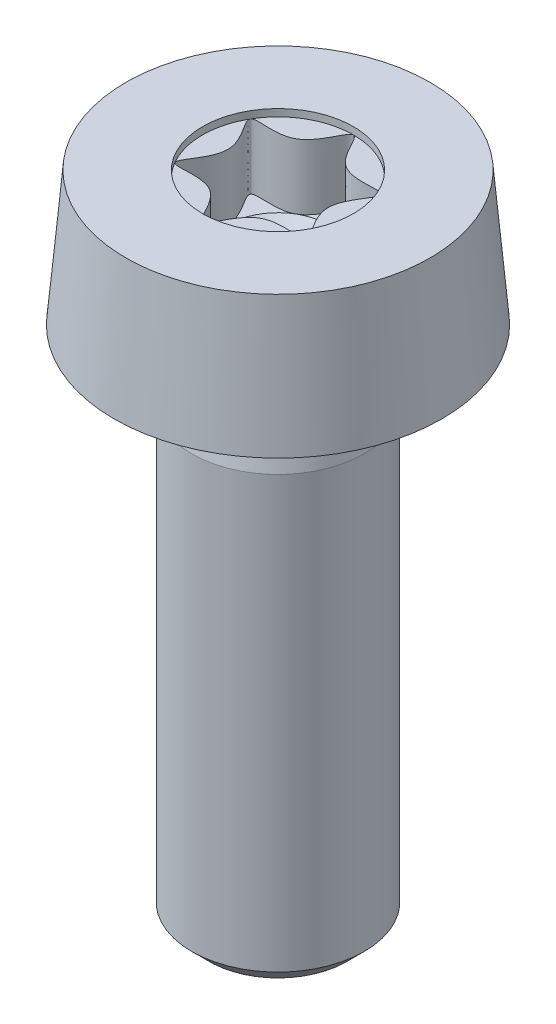
from build123d import *

# Parameters (mm, degrees)
FILLET1_R                 = 0.1
SOCKET_CUT_EXTRUDE1_DEPTH = 0.84
SKETCH3_R                 = 0.875
SOCKET_CUT_EXTRUDE2_DEPTH = 0.084
CHAFL_N1_SIZE             = 0.2


with BuildPart() as part:
    # Sketch1 → Body-Revolve (revolve)
    with BuildSketch(Plane.XY, mode=Mode.PRIVATE) as body_revolve_sk:
        Polygon((0, 7.55), (1.764392572, 7.55), (1.9, 6), (1, 6), (0.84, 6), (1, 5.2), (1, 0), (0, 0), align=None)
    revolve(body_revolve_sk.sketch.rotate(Axis((0, 0, 0), (0, 1, 0)), 90), axis=Axis((0, 0, 0), (0, 1, 0)))

    # Fillet1
    fillet1_edges = [part.edges().sort_by_distance(p)[0] for p in [
        (0, 6, 0.84),
    ]]
    fillet(fillet1_edges, radius=FILLET1_R)

    # Sketch2 → Socket-Cut-Extrude1 (cut)
    with BuildSketch(Plane(origin=(0, 7.55, 0), x_dir=(-1, 0, 0), z_dir=(0, 1, 0))):
        with BuildLine():
            add(Edge.make_bspline(
                [(0, -0.875), (-0.062906837, -0.875), (-0.18872051, -0.326873512), (-0.99511796, -0.574531622), (-0.37744102, 0), (-0.99511796, 0.574531622), (-0.18872051, 0.326873512), (0, 1.149063244), (0.18872051, 0.326873512), (0.99511796, 0.574531622), (0.37744102, 0), (0.99511796, -0.574531622), (0.18872051, -0.326873512), (0.062906837, -0.875), (0, -0.875)],
                knots=[0, 0, 0, 0, 0.083333333, 0.166666667, 0.25, 0.333333333, 0.416666667, 0.5, 0.583333333, 0.666666667, 0.75, 0.833333333, 0.916666667, 1, 1, 1, 1], degree=3))
        make_face()
    extrude(amount=-SOCKET_CUT_EXTRUDE1_DEPTH, mode=Mode.SUBTRACT)

    # Sketch3 → Socket-Cut-Extrude2 (cut)
    with BuildSketch(Plane(origin=(0, 7.55, 0), x_dir=(-1, 0, 0), z_dir=(0, 1, 0))):
        with Locations(Location((0, 0, 0), (0, 0, 90))):
            Circle(SKETCH3_R)
    extrude(amount=-SOCKET_CUT_EXTRUDE2_DEPTH, mode=Mode.SUBTRACT)

    # Sketch4 → Drill-Cut-Revolve (revolve, cut)
    with BuildSketch(Plane.XY, mode=Mode.PRIVATE) as drill_cut_revolve_sk:
        Polygon((0, 6.71), (0.583333333, 6.71), (0, 6.155), align=None)
    revolve(drill_cut_revolve_sk.sketch.rotate(Axis((0, 0, 0), (0, 1, 0)), 270), axis=Axis((0, 0, 0), (0, 1, 0)), mode=Mode.SUBTRACT)

    # Chaflán1
    chafl_n1_edges = [part.edges().sort_by_distance(p)[0] for p in [
        (0, 0, 1),
    ]]
    chamfer(chafl_n1_edges, length=CHAFL_N1_SIZE)


solid = part.part
